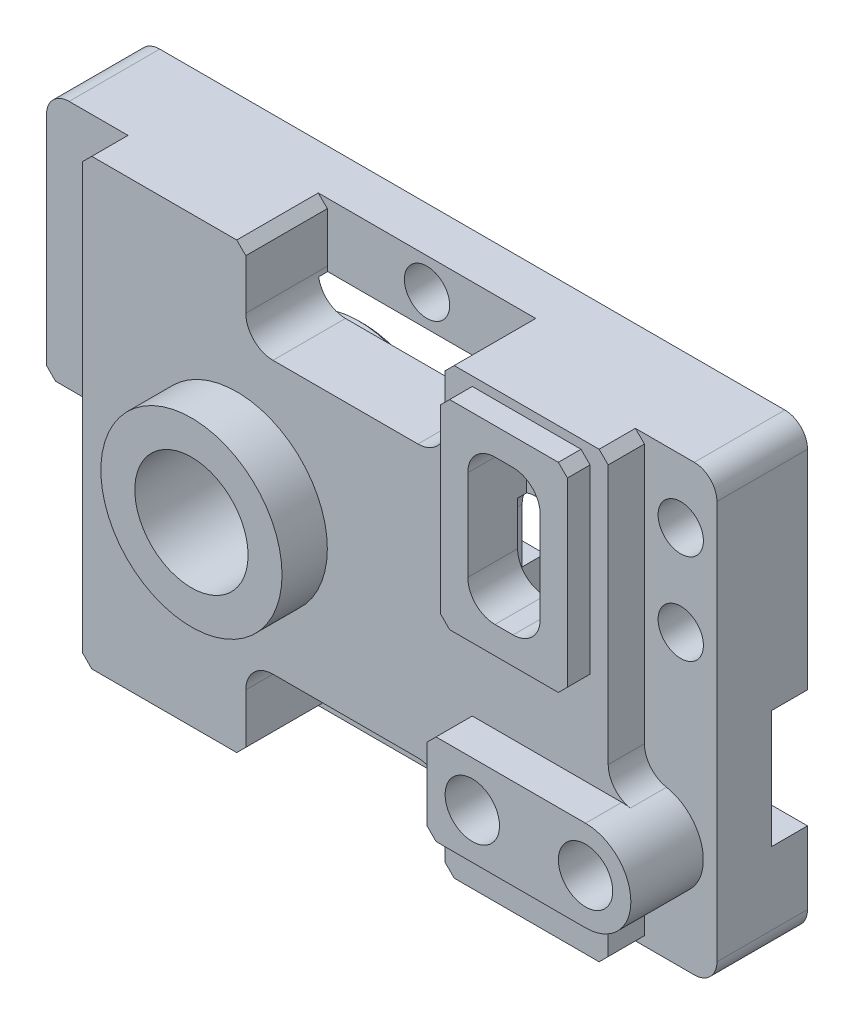
from build123d import *

# Parameters (mm, degrees)
SKETCH_1_W                  = 148
SKETCH_1_H                  = 98
EXTRUDE_1_DEPTH             = 28
FILLET_1_R                  = 5
SKETCH_3_W                  = 110
SKETCH_3_H                  = 70
CUT_EXTRUDE_1_DEPTH         = 12
FILLET_2_R                  = 6
CUT_EXTRUDE_2_DEPTH         = 5
CUT_EXTRUDE_3_DEPTH         = 5
SKETCH_7_W                  = 7
SKETCH_7_H                  = 14
EXTRUDE_2_DEPTH             = 5
SKETCH_8_R                  = 20
EXTRUDE_3_DEPTH             = 12
SKETCH_9_R                  = 15
CUT_EXTRUDE_4_DEPTH         = 20
SKETCH_10_W                 = 10
SKETCH_10_H                 = 26
CUT_EXTRUDE_5_DEPTH         = 8
CUT_EXTRUDE_6_DEPTH         = 18
CUT_EXTRUDE_7_DEPTH         = 8
SKETCH_14_W                 = 16
SKETCH_14_H                 = 98
CUT_EXTRUDE_8_DEPTH         = 8
CUT_EXTRUDE_9_DEPTH         = 8
CHAMFER_1_SIZE              = 2
EXTRUDE_START               = 10
SKETCH_17_R                 = 20
EXTRUDE_4_DEPTH             = 10
CHAMFER_2_SIZE              = 1
SKETCH_18_R                 = 12.5
CUT_EXTRUDE_10_DEPTH        = 97.545326143
SKETCH_19_W                 = 28
SKETCH_19_H                 = 44
EXTRUDE_5_DEPTH             = 5
SKETCH_20_W                 = 16
SKETCH_20_H                 = 32
CUT_EXTRUDE_11_DEPTH        = 13
FILLET_3_R                  = 6
CHAMFER_3_SIZE              = 2
EXTRUDE_START_2             = 8
EXTRUDE_6_DEPTH             = 8
CHAMFER_4_SIZE              = 2
CUT_EXTRUDE_12_DEPTH        = 97.545326143
SKETCH_23_R                 = 5
CUT_EXTRUDE_13_DEPTH        = 97.545326143
HOLE_WIZARD_12_0_12_1_D     = 12
HOLE_WIZARD_12_0_12_1_DEPTH = 10
HOLE_WIZARD_12_0_12_1_TIP   = 3.605163714
SKETCH_26_R                 = 5
CUT_EXTRUDE_14_DEPTH        = 91.978019323


with BuildPart() as part:
    # 草图1 → 凸台-拉伸1 (new body)
    with BuildSketch(Plane.XY):
        Rectangle(SKETCH_1_W, SKETCH_1_H)
    extrude(amount=EXTRUDE_1_DEPTH)

    # 圆角1
    fillet_1_edges = [part.edges().sort_by_distance(p)[0] for p in [
        (-74, 49, 14),
        (74, 49, 14),
        (74, -49, 14),
        (-74, -49, 14),
    ]]
    fillet(fillet_1_edges, radius=FILLET_1_R)

    # 草图3 → 切除-拉伸1 (cut)
    with BuildSketch(Plane(origin=(0, 0, 0), x_dir=(-1, 0, 0), z_dir=(0, 0, -1))):
        with BuildLine():
            Line((-58, -35), (-55, -35))
            Line((-55, -35), (-55, 5))
            Line((-55, 5), (-58, 5))
            ThreePointArc((-58, 5), (-62.242640687, 3.242640687), (-64, -1))
            Line((-64, -1), (-64, -29))
            ThreePointArc((-64, -29), (-62.242640687, -33.242640687), (-58, -35))
        make_face()
        Rectangle(SKETCH_3_W, SKETCH_3_H)
        with BuildLine():
            Line((55, 35), (55, -5))
            Line((55, -5), (58, -5))
            ThreePointArc((58, -5), (62.242640687, -3.242640687), (64, 1))
            Line((64, 1), (64, 29))
            ThreePointArc((64, 29), (62.242640687, 33.242640687), (58, 35))
            Line((58, 35), (55, 35))
        make_face()
    extrude(amount=-CUT_EXTRUDE_1_DEPTH, mode=Mode.SUBTRACT)

    # 圆角2
    fillet_2_edges = [part.edges().sort_by_distance(p)[0] for p in [
        (55, 35, 6),
        (-55, -35, 6),
    ]]
    fillet(fillet_2_edges, radius=FILLET_2_R)

    # 草图4 → 切除-拉伸2 (cut)
    with BuildSketch(Plane(origin=(0, 0, 12), x_dir=(-1, 0, 0), z_dir=(0, 0, -1))):
        with BuildLine():
            Line((-46, -25), (-13, -25))
            ThreePointArc((-13, -25), (-8.757359313, -23.242640687), (-7, -19))
            Line((-7, -19), (-7, 19))
            ThreePointArc((-7, 19), (-8.757359313, 23.242640687), (-13, 25))
            Line((-13, 25), (-46, 25))
            ThreePointArc((-46, 25), (-50.242640687, 23.242640687), (-52, 19))
            Line((-52, 19), (-52, -19))
            ThreePointArc((-52, -19), (-50.242640687, -23.242640687), (-46, -25))
        make_face()
    extrude(amount=-CUT_EXTRUDE_2_DEPTH, mode=Mode.SUBTRACT)

    # 草图6 → 切除-拉伸3 (cut)
    with BuildSketch(Plane(origin=(0, 0, 17), x_dir=(-1, 0, 0), z_dir=(0, 0, -1))):
        with BuildLine():
            Line((-46, -25), (-34, -25))
            ThreePointArc((-34, -25), (-29.757359313, -23.242640687), (-28, -19))
            Line((-28, -19), (-28, 19))
            ThreePointArc((-28, 19), (-29.757359313, 23.242640687), (-34, 25))
            Line((-34, 25), (-46, 25))
            ThreePointArc((-46, 25), (-50.242640687, 23.242640687), (-52, 19))
            Line((-52, 19), (-52, -19))
            ThreePointArc((-52, -19), (-50.242640687, -23.242640687), (-46, -25))
        make_face()
    extrude(amount=-CUT_EXTRUDE_3_DEPTH, mode=Mode.SUBTRACT)

    # 草图7 → 凸台-拉伸2 (add)
    with BuildSketch(Plane(origin=(0, 0, 17), x_dir=(-1, 0, 0), z_dir=(0, 0, -1))):
        with Locations((-24.5, 0)):
            Rectangle(SKETCH_7_W, SKETCH_7_H)
    extrude(amount=EXTRUDE_2_DEPTH)

    # 草图8 → 凸台-拉伸3 (add)
    with BuildSketch(Plane(origin=(0, 0, 12), x_dir=(-1, 0, 0), z_dir=(0, 0, -1))):
        with Locations((24, 0)):
            Circle(SKETCH_8_R)
    extrude(amount=EXTRUDE_3_DEPTH)

    # 草图9 → 切除-拉伸4 (cut)
    with BuildSketch(Plane(origin=(0, 0, 0), x_dir=(-1, 0, 0), z_dir=(0, 0, -1))):
        with Locations((24, 0)):
            Circle(SKETCH_9_R)
    extrude(amount=-CUT_EXTRUDE_4_DEPTH, mode=Mode.SUBTRACT)

    # 草图10 → 切除-拉伸5 (cut)
    with BuildSketch(Plane(origin=(0, 0, 0), x_dir=(-1, 0, 0), z_dir=(0, 0, -1))):
        with Locations((-69, -15)):
            Rectangle(SKETCH_10_W, SKETCH_10_H)
        with Locations((69, 15)):
            Rectangle(SKETCH_10_W, SKETCH_10_H)
    extrude(amount=-CUT_EXTRUDE_5_DEPTH, mode=Mode.SUBTRACT)

    # 草图12 → 切除-拉伸6 (cut)
    with BuildSketch(Plane.XY.offset(28)):
        with BuildLine():
            Line((22, -49), (-22, -49))
            Line((-22, -49), (-22, -36))
            ThreePointArc((-22, -36), (-20.242640687, -31.757359313), (-16, -30))
            Line((-16, -30), (16, -30))
            ThreePointArc((16, -30), (20.242640687, -31.757359313), (22, -36))
            Line((22, -36), (22, -49))
        make_face()
        with BuildLine():
            Line((-22, 49), (-22, 36))
            ThreePointArc((-22, 36), (-20.242640687, 31.757359313), (-16, 30))
            Line((-16, 30), (16, 30))
            ThreePointArc((16, 30), (20.242640687, 31.757359313), (22, 36))
            Line((22, 36), (22, 49))
            Line((22, 49), (-22, 49))
        make_face()
    extrude(amount=-CUT_EXTRUDE_6_DEPTH, mode=Mode.SUBTRACT)

    # 草图13 → 切除-拉伸7 (cut)
    with BuildSketch(Plane.XY.offset(28)):
        with BuildLine():
            Line((74, -49), (58, -49))
            Line((58, -49), (58, -41.716233646))
            ThreePointArc((58, -41.716233646), (59.376689498, -37.89196901), (62.875, -35.822646028))
            ThreePointArc((62.875, -35.822646028), (71, -26), (62.875, -16.177353972))
            ThreePointArc((62.875, -16.177353972), (59.376689498, -14.10803099), (58, -10.283766354))
            Line((58, -10.283766354), (58, 49))
            Line((58, 49), (74, 49))
            Line((74, 49), (74, -49))
        make_face()
    extrude(amount=-CUT_EXTRUDE_7_DEPTH, mode=Mode.SUBTRACT)

    # 草图14 → 切除-拉伸8 (cut)
    with BuildSketch(Plane.XY.offset(28)):
        with Locations((-66, 0)):
            Rectangle(SKETCH_14_W, SKETCH_14_H)
    extrude(amount=-CUT_EXTRUDE_8_DEPTH, mode=Mode.SUBTRACT)

    # 草图15 → 切除-拉伸9 (cut)
    with BuildSketch(Plane.XY.offset(20)):
        with BuildLine():
            Line((-58, -49), (-74, -49))
            Line((-74, -49), (-74, -6))
            Line((-74, -6), (-64, -6))
            ThreePointArc((-64, -6), (-59.757359313, -7.757359313), (-58, -12))
            Line((-58, -12), (-58, -49))
        make_face()
    extrude(amount=-CUT_EXTRUDE_9_DEPTH, mode=Mode.SUBTRACT)

    # 倒角1
    chamfer_1_edges = [part.edges().sort_by_distance(p)[0] for p in [
        (22, -49, 19),
        (-22, -49, 19),
        (-22, 49, 19),
        (22, 49, 19),
        (58, 49, 24),
        (58, -49, 24),
        (-58, 49, 24),
        (-58, -49, 20),
        (-74, -6, 16),
    ]]
    chamfer(chamfer_1_edges, length=CHAMFER_1_SIZE)

    # 草图17 → 凸台-拉伸4 (add)
    with BuildSketch(Plane.XY.offset(28).offset(EXTRUDE_START)):
        with Locations(Location((-24, 0, 0), (0, 0, 180))):
            Circle(SKETCH_17_R)
    extrude(amount=-EXTRUDE_4_DEPTH)

    # 倒角2
    chamfer_2_edges = [part.edges().sort_by_distance(p)[0] for p in [
        (-4, 0, 0),
        (-9, 0, 0),
    ]]
    chamfer(chamfer_2_edges, length=CHAMFER_2_SIZE)

    # 草图18 → 切除-拉伸10 (cut, through all)
    with BuildSketch(Plane.XY.offset(38)):
        with Locations((-24, 0)):
            Circle(SKETCH_18_R)
    extrude(amount=-CUT_EXTRUDE_10_DEPTH, mode=Mode.SUBTRACT)

    # 草图19 → 凸台-拉伸5 (add)
    with BuildSketch(Plane.XY.offset(28)):
        with Locations((40, 25)):
            Rectangle(SKETCH_19_W, SKETCH_19_H)
    extrude(amount=EXTRUDE_5_DEPTH)

    # 草图20 → 切除-拉伸11 (cut)
    with BuildSketch(Plane.XY.offset(33)):
        with Locations((40, 25)):
            Rectangle(SKETCH_20_W, SKETCH_20_H)
    extrude(amount=-CUT_EXTRUDE_11_DEPTH, mode=Mode.SUBTRACT)

    # 圆角3
    fillet_3_edges = [part.edges().sort_by_distance(p)[0] for p in [
        (32, 9, 27.5),
        (48, 41, 26.5),
        (32, 41, 26.5),
        (48, 9, 27.5),
    ]]
    fillet(fillet_3_edges, radius=FILLET_3_R)

    # 倒角3
    chamfer_3_edges = [part.edges().sort_by_distance(p)[0] for p in [
        (54, 3, 30.5),
        (54, 47, 30.5),
        (26, 47, 30.5),
        (26, 3, 30.5),
    ]]
    chamfer(chamfer_3_edges, length=CHAMFER_3_SIZE)

    # 草图21 → 凸台-拉伸6 (add)
    with BuildSketch(Plane.XY.offset(28).offset(EXTRUDE_START_2)):
        with BuildLine():
            Line((26, -16), (26, -36))
            Line((26, -36), (61, -36))
            ThreePointArc((61, -36), (61.941684585, -35.955562774), (62.875, -35.822646028))
            ThreePointArc((62.875, -35.822646028), (71, -26), (62.875, -16.177353972))
            ThreePointArc((62.875, -16.177353972), (61.941684585, -16.044437226), (61, -16))
            Line((61, -16), (26, -16))
        make_face()
    extrude(amount=-EXTRUDE_6_DEPTH)

    # 倒角4
    chamfer_4_edges = [part.edges().sort_by_distance(p)[0] for p in [
        (26, -16, 32),
        (26, -36, 32),
    ]]
    chamfer(chamfer_4_edges, length=CHAMFER_4_SIZE)

    # 草图22 → 切除-拉伸12 (cut, through all)
    with BuildSketch(Plane(origin=(0, 0, 0), x_dir=(-1, 0, 0), z_dir=(0, 0, -1))):
        with BuildLine():
            Line((62.19694392, -35), (62.19694392, -15))
            ThreePointArc((62.19694392, -15), (66.19694392, -11), (70.19694392, -15))
            Line((70.19694392, -15), (70.19694392, -35))
            ThreePointArc((70.19694392, -35), (66.19694392, -39), (62.19694392, -35))
        make_face()
    extrude(amount=-CUT_EXTRUDE_12_DEPTH, mode=Mode.SUBTRACT)

    # 草图23 → 切除-拉伸13 (cut, through all)
    with BuildSketch(Plane(origin=(0, 0, 0), x_dir=(-1, 0, 0), z_dir=(0, 0, -1))):
        with Locations((0, 42)):
            Circle(SKETCH_23_R)
        with Locations((0, -42)):
            Circle(SKETCH_23_R)
    extrude(amount=-CUT_EXTRUDE_13_DEPTH, mode=Mode.SUBTRACT)

    # Ø12.0 (12) 直径孔1
    with Locations(Plane(origin=(61, -26, 36), x_dir=(1, 0, 0), z_dir=(0, 0, 1))):
        with Locations((0, 0), (-25, 0)):
            Hole(HOLE_WIZARD_12_0_12_1_D / 2, depth=HOLE_WIZARD_12_0_12_1_DEPTH)
            with Locations((0, 0, -(HOLE_WIZARD_12_0_12_1_DEPTH + HOLE_WIZARD_12_0_12_1_TIP / 2))):  # 118° drill point
                Cone(0, HOLE_WIZARD_12_0_12_1_D / 2, HOLE_WIZARD_12_0_12_1_TIP, mode=Mode.SUBTRACT)

    # 草图26 → 切除-拉伸14 (cut, through all)
    with BuildSketch(Plane.XY.offset(20)):
        with Locations((66.01411415, 35)):
            Circle(SKETCH_26_R)
        with Locations((66.01411415, 15)):
            Circle(SKETCH_26_R)
    extrude(amount=-CUT_EXTRUDE_14_DEPTH, mode=Mode.SUBTRACT)


solid = part.part
